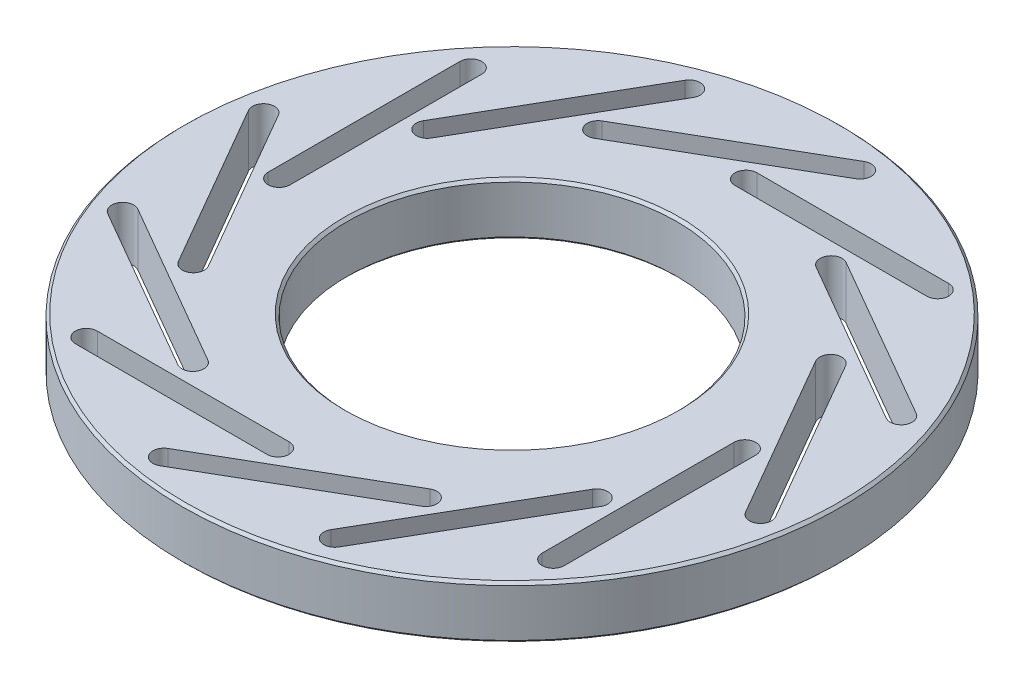
from build123d import *

# Parameters (mm, degrees)
SKETCH1_R           = 25
SKETCH1_R_2         = 12.5
BOSS_EXTRUDE1_DEPTH = 4
CHAMFER1_SIZE       = 0.2


with BuildPart() as part:
    # Sketch1 → Boss-Extrude1 (new body)
    with BuildSketch(Plane(origin=(0, 0, 0), x_dir=(1, 0, 0), z_dir=(0, 1, 0))):
        with Locations(Location((0, 0, 0), (0, 0, 270))):
            Circle(SKETCH1_R)
        with Locations(Location((0, 0, 0), (0, 0, 270))):
            Circle(SKETCH1_R_2, mode=Mode.SUBTRACT)
        with BuildLine():
            Line((16.875, -14.583333333), (16.875, -0.041666667))
            ThreePointArc((16.875, -0.041666667), (17.708333333, 0.791666667), (18.541666667, -0.041666667))
            Line((18.541666667, -0.041666667), (18.541666667, -14.583333333))
            ThreePointArc((18.541666667, -14.583333333), (17.708333333, -15.416666667), (16.875, -14.583333333))
        make_face(mode=Mode.SUBTRACT)
        with BuildLine():
            Line((16.078387695, 9.234748942), (23.349221029, -3.358703805))
            ThreePointArc((23.349221029, -3.358703805), (23.044199859, -4.497058308), (21.905845356, -4.192037139))
            Line((21.905845356, -4.192037139), (14.635012022, 8.401415608))
            ThreePointArc((14.635012022, 8.401415608), (14.940033192, 9.539770111), (16.078387695, 9.234748942))
        make_face(mode=Mode.SUBTRACT)
        with BuildLine():
            Line((7.322512022, -21.067037139), (14.593345356, -8.473584392))
            ThreePointArc((14.593345356, -8.473584392), (15.731699859, -8.168563222), (16.036721029, -9.306917725))
            Line((16.036721029, -9.306917725), (8.765887695, -21.900370472))
            ThreePointArc((8.765887695, -21.900370472), (7.627533192, -22.205391642), (7.322512022, -21.067037139))
        make_face(mode=Mode.SUBTRACT)
        with BuildLine():
            Line((-4.192037139, -21.905845356), (8.401415608, -14.635012022))
            ThreePointArc((8.401415608, -14.635012022), (9.539770111, -14.940033192), (9.234748942, -16.078387695))
            Line((9.234748942, -16.078387695), (-3.358703805, -23.349221029))
            ThreePointArc((-3.358703805, -23.349221029), (-4.497058308, -23.044199859), (-4.192037139, -21.905845356))
        make_face(mode=Mode.SUBTRACT)
        with BuildLine():
            Line((-14.583333333, -16.875), (-0.041666667, -16.875))
            ThreePointArc((-0.041666667, -16.875), (0.791666667, -17.708333333), (-0.041666667, -18.541666667))
            Line((-0.041666667, -18.541666667), (-14.583333333, -18.541666667))
            ThreePointArc((-14.583333333, -18.541666667), (-15.416666667, -17.708333333), (-14.583333333, -16.875))
        make_face(mode=Mode.SUBTRACT)
        with BuildLine():
            Line((-21.067037139, -7.322512022), (-8.473584392, -14.593345356))
            ThreePointArc((-8.473584392, -14.593345356), (-8.168563222, -15.731699859), (-9.306917725, -16.036721029))
            Line((-9.306917725, -16.036721029), (-21.900370472, -8.765887695))
            ThreePointArc((-21.900370472, -8.765887695), (-22.205391642, -7.627533192), (-21.067037139, -7.322512022))
        make_face(mode=Mode.SUBTRACT)
        with BuildLine():
            Line((-21.905845356, 4.192037139), (-14.635012022, -8.401415608))
            ThreePointArc((-14.635012022, -8.401415608), (-14.940033192, -9.539770111), (-16.078387695, -9.234748942))
            Line((-16.078387695, -9.234748942), (-23.349221029, 3.358703805))
            ThreePointArc((-23.349221029, 3.358703805), (-23.044199859, 4.497058308), (-21.905845356, 4.192037139))
        make_face(mode=Mode.SUBTRACT)
        with BuildLine():
            Line((-16.875, 14.583333333), (-16.875, 0.041666667))
            ThreePointArc((-16.875, 0.041666667), (-17.708333333, -0.791666667), (-18.541666667, 0.041666667))
            Line((-18.541666667, 0.041666667), (-18.541666667, 14.583333333))
            ThreePointArc((-18.541666667, 14.583333333), (-17.708333333, 15.416666667), (-16.875, 14.583333333))
        make_face(mode=Mode.SUBTRACT)
        with BuildLine():
            Line((-7.322512022, 21.067037139), (-14.593345356, 8.473584392))
            ThreePointArc((-14.593345356, 8.473584392), (-15.731699859, 8.168563222), (-16.036721029, 9.306917725))
            Line((-16.036721029, 9.306917725), (-8.765887695, 21.900370472))
            ThreePointArc((-8.765887695, 21.900370472), (-7.627533192, 22.205391642), (-7.322512022, 21.067037139))
        make_face(mode=Mode.SUBTRACT)
        with BuildLine():
            Line((4.192037139, 21.905845356), (-8.401415608, 14.635012022))
            ThreePointArc((-8.401415608, 14.635012022), (-9.539770111, 14.940033192), (-9.234748942, 16.078387695))
            Line((-9.234748942, 16.078387695), (3.358703805, 23.349221029))
            ThreePointArc((3.358703805, 23.349221029), (4.497058308, 23.044199859), (4.192037139, 21.905845356))
        make_face(mode=Mode.SUBTRACT)
        with BuildLine():
            Line((14.583333333, 16.875), (0.041666667, 16.875))
            ThreePointArc((0.041666667, 16.875), (-0.791666667, 17.708333333), (0.041666667, 18.541666667))
            Line((0.041666667, 18.541666667), (14.583333333, 18.541666667))
            ThreePointArc((14.583333333, 18.541666667), (15.416666667, 17.708333333), (14.583333333, 16.875))
        make_face(mode=Mode.SUBTRACT)
        with BuildLine():
            Line((21.067037139, 7.322512022), (8.473584392, 14.593345356))
            ThreePointArc((8.473584392, 14.593345356), (8.168563222, 15.731699859), (9.306917725, 16.036721029))
            Line((9.306917725, 16.036721029), (21.900370472, 8.765887695))
            ThreePointArc((21.900370472, 8.765887695), (22.205391642, 7.627533192), (21.067037139, 7.322512022))
        make_face(mode=Mode.SUBTRACT)
    extrude(amount=BOSS_EXTRUDE1_DEPTH)

    # Chamfer1
    chamfer1_edges = [part.edges().sort_by_distance(p)[0] for p in [
        (0, 0, -12.5),
        (0, 4, -12.5),
        (0, 0, -25),
        (0, 4, -25),
    ]]
    chamfer(chamfer1_edges, length=CHAMFER1_SIZE)


solid = part.part
